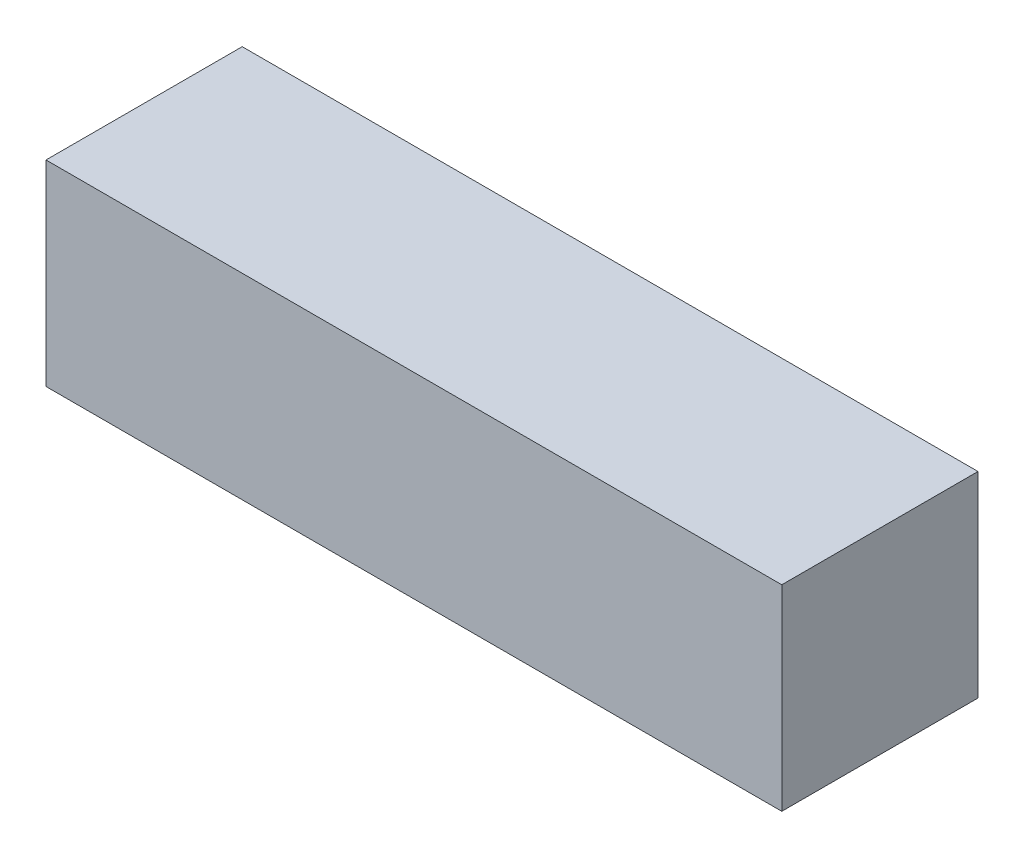
from build123d import *

# Parameters (mm, degrees)
SKETCH1_W           = 150
SKETCH1_H           = 40
BOSS_EXTRUDE1_DEPTH = 40


with BuildPart() as part:
    # Sketch1 → Boss-Extrude1 (new body)
    with BuildSketch(Plane(origin=(0, 0, 0), x_dir=(1, 0, 0), z_dir=(0, 1, 0))):
        with Locations((75, 20)):
            Rectangle(SKETCH1_W, SKETCH1_H)
    extrude(amount=BOSS_EXTRUDE1_DEPTH)


solid = part.part
